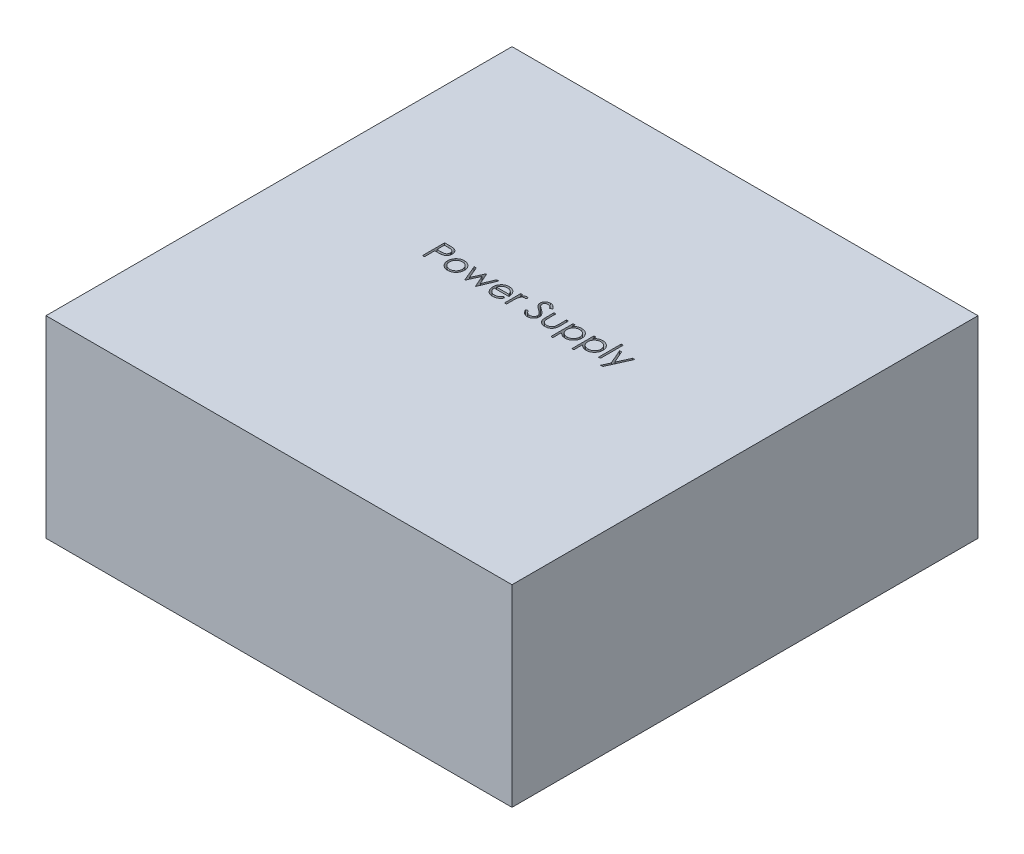
from build123d import *

# Parameters (mm, degrees)
SKETCH1_W           = 73.66
SKETCH1_H           = 73.66
BOSS_EXTRUDE1_DEPTH = 30.48
SKETCH2_W           = 0.314102564
SKETCH2_H           = 3.58974359
CUT_EXTRUDE1_DEPTH  = 3


with BuildPart() as part:
    # Sketch1 → Boss-Extrude1 (new body)
    with BuildSketch(Plane(origin=(0, 0, 0), x_dir=(1, 0, 0), z_dir=(0, 1, 0))):
        with Locations((-36.83, 36.83)):
            Rectangle(SKETCH1_W, SKETCH1_H)
    extrude(amount=BOSS_EXTRUDE1_DEPTH)

    # Sketch2 → Cut-Extrude1 (cut)
    # profile 1 of 11: a face of its own
    with BuildSketch(Plane(origin=(0, 30.48, 0), x_dir=(1, 0, 0), z_dir=(0, 1, 0))):
        with BuildLine():
            Line((-52.131282051, 41.489150847), (-51.444883814, 41.489150847))
            add(Edge.make_bspline(
                [(-51.444883814, 41.489150847), (-51.397672908, 41.489098951), (-51.307214715, 41.488999515), (-51.177499659, 41.485984769), (-51.059689928, 41.481958077), (-50.954039547, 41.476376184), (-50.860223449, 41.469779594), (-50.778666149, 41.460527555), (-50.708726593, 41.450867259), (-50.666820143, 41.441045852), (-50.647708333, 41.436566712)],
                knots=[0, 0, 0, 0, 1.415646017, 2.712440637, 3.8905458, 4.950247383, 5.884950622, 6.709939814, 7.411656543, 8, 8, 8, 8], degree=3))
            add(Edge.make_bspline(
                [(-50.647708333, 41.436566712), (-50.6235148, 41.429944763), (-50.575697822, 41.416856901), (-50.506796779, 41.390643177), (-50.441242934, 41.359561012), (-50.378811375, 41.324137072), (-50.320269292, 41.282851508), (-50.264743251, 41.23737789), (-50.212723271, 41.186666322), (-50.164501879, 41.131285582), (-50.120217082, 41.072165372), (-50.082087399, 41.008423142), (-50.050160172, 40.941131839), (-50.0227769, 40.870338268), (-50.003068446, 40.795447944), (-49.988221546, 40.716981232), (-49.978797918, 40.634946542), (-49.977895357, 40.578886674), (-49.977435897, 40.550348764)],
                knots=[0, 0, 0, 0, 0.999701418, 1.975846123, 2.934577507, 3.890451536, 4.834027766, 5.787354733, 6.749476667, 7.726910423, 8.712836071, 9.690891519, 10.682875813, 11.679750201, 12.712814741, 13.765529915, 14.8625177, 16, 16, 16, 16], degree=3))
            add(Edge.make_bspline(
                [(-49.977435897, 40.550348764), (-49.977857322, 40.521570987), (-49.978681868, 40.465265323), (-49.988578153, 40.382892535), (-50.001908345, 40.304174145), (-50.022405397, 40.229284694), (-50.04925107, 40.158668924), (-50.080743123, 40.091247692), (-50.118726654, 40.02816802), (-50.162371483, 39.969200902), (-50.210923078, 39.91429099), (-50.264176016, 39.863836195), (-50.321915308, 39.818131857), (-50.383957457, 39.777075513), (-50.450907305, 39.741619234), (-50.521749459, 39.709861929), (-50.597099675, 39.683190868), (-50.649242189, 39.669160807), (-50.675753205, 39.66202745)],
                knots=[0, 0, 0, 0, 1.121902311, 2.195077645, 3.232258892, 4.234102512, 5.217864754, 6.176164875, 7.132989551, 8.084763148, 9.034132444, 9.988522005, 10.94243251, 11.903244335, 12.886203696, 13.894208494, 14.929344452, 16, 16, 16, 16], degree=3))
            add(Edge.make_bspline(
                [(-50.675753205, 39.66202745), (-50.697680539, 39.657364469), (-50.745735566, 39.647145274), (-50.824878289, 39.635736818), (-50.917023675, 39.625999217), (-51.022045955, 39.618698079), (-51.139850859, 39.612447711), (-51.270502117, 39.607479617), (-51.414256194, 39.604749763), (-51.514527438, 39.60460897), (-51.566879006, 39.604535462)],
                knots=[0, 0, 0, 0, 0.601384939, 1.31797006, 2.144135048, 3.087295005, 4.142315834, 5.309527816, 6.595305764, 8, 8, 8, 8], degree=3))
            Line((-51.566879006, 39.604535462), (-51.817179487, 39.604535462))
            Line((-51.817179487, 39.604535462), (-51.817179487, 37.989150847))
            Line((-51.817179487, 37.989150847), (-52.131282051, 37.989150847))
            Line((-52.131282051, 37.989150847), (-52.131282051, 41.489150847))
        make_face()
        with BuildLine():
            Line((-51.817179487, 41.130176488), (-51.817179487, 39.963509821))
            Line((-51.817179487, 39.963509821), (-51.204399038, 39.955797482))
            add(Edge.make_bspline(
                [(-51.204399038, 39.955797482), (-51.174479113, 39.955782018), (-51.116719313, 39.955752166), (-51.033283089, 39.959737389), (-50.955873802, 39.964337922), (-50.884729227, 39.971073846), (-50.819817292, 39.980595103), (-50.761029763, 39.990206841), (-50.708822481, 40.004112204), (-50.647723279, 40.022835273), (-50.579639931, 40.054767888), (-50.505572383, 40.101117778), (-50.442801796, 40.160198487), (-50.3884835, 40.226626318), (-50.345377622, 40.300525447), (-50.313821629, 40.379594384), (-50.295280472, 40.463022234), (-50.292794278, 40.520110372), (-50.291538462, 40.54894652)],
                knots=[0, 0, 0, 0, 1.160613943, 2.240541288, 3.23993089, 4.169200891, 5.011653406, 5.7853311, 6.478053781, 7.106038997, 8.262395093, 9.384106736, 10.481365981, 11.59014053, 12.70357646, 13.786202915, 14.881775077, 16, 16, 16, 16], degree=3))
            add(Edge.make_bspline(
                [(-50.291538462, 40.54894652), (-50.292801108, 40.577085034), (-50.295311093, 40.633020916), (-50.313966956, 40.714999676), (-50.34531627, 40.793235381), (-50.388772865, 40.866208466), (-50.441513994, 40.93239727), (-50.502813338, 40.989894397), (-50.572526599, 41.0361161), (-50.63737483, 41.065949381), (-50.694976016, 41.084164657), (-50.745007976, 41.096909497), (-50.80149865, 41.107085104), (-50.86446643, 41.115324606), (-50.933423264, 41.122378068), (-51.008961579, 41.127164045), (-51.090795222, 41.129965501), (-51.147605793, 41.130104456), (-51.177055288, 41.130176488)],
                knots=[0, 0, 0, 0, 1.120700087, 2.227813068, 3.331159281, 4.466773991, 5.599788987, 6.693661531, 7.80175334, 8.91857717, 9.525282508, 10.207424825, 10.974604443, 11.810962634, 12.737642355, 13.736264703, 14.826523623, 16, 16, 16, 16], degree=3))
            Line((-51.177055288, 41.130176488), (-51.817179487, 41.130176488))
        make_face(mode=Mode.SUBTRACT)
    # profile 2 of 11: a face of its own
    with BuildSketch(Plane(origin=(0, 30.48, 0), x_dir=(1, 0, 0), z_dir=(0, 1, 0))):
        with BuildLine():
            add(Edge.make_bspline(
                [(-48.113854167, 40.59171495), (-48.065862894, 40.590693058), (-47.971763736, 40.58868938), (-47.83395585, 40.567274414), (-47.702410714, 40.53452705), (-47.576624522, 40.489255488), (-47.458208227, 40.428573537), (-47.345436983, 40.356164246), (-47.238619974, 40.270381652), (-47.174596945, 40.204023584), (-47.142099359, 40.170340751)],
                knots=[0, 0, 0, 0, 1.054011418, 2.066658804, 3.057071809, 4.030435133, 4.997543892, 5.974964718, 6.972108034, 8, 8, 8, 8], degree=3))
            add(Edge.make_bspline(
                [(-47.142099359, 40.170340751), (-47.114117405, 40.138126765), (-47.058695025, 40.074322223), (-46.987629306, 39.97086661), (-46.926407746, 39.863726509), (-46.877344785, 39.751479183), (-46.838659761, 39.635104511), (-46.811194065, 39.5142025), (-46.79485713, 39.389040153), (-46.792654163, 39.304036315), (-46.791538462, 39.260985783)],
                knots=[0, 0, 0, 0, 1.025258237, 2.030674902, 3.01204498, 3.988269485, 4.97094183, 5.956517959, 6.965070386, 8, 8, 8, 8], degree=3))
            add(Edge.make_bspline(
                [(-46.791538462, 39.260985783), (-46.792519799, 39.217685725), (-46.794458967, 39.132122792), (-46.812802584, 39.006103426), (-46.841333669, 38.883908603), (-46.882165508, 38.76604991), (-46.934523617, 38.652167082), (-46.998414304, 38.542757533), (-47.074285922, 38.4376054), (-47.160289918, 38.337603561), (-47.255341794, 38.245437347), (-47.358457943, 38.165109077), (-47.467611977, 38.096287553), (-47.58425533, 38.040851137), (-47.707322817, 37.997141437), (-47.837079885, 37.96644142), (-47.973324955, 37.947879737), (-48.066352176, 37.945496163), (-48.113854167, 37.944279052)],
                knots=[0, 0, 0, 0, 0.998656419, 1.973391657, 2.932242238, 3.890759089, 4.846373663, 5.82037756, 6.809684879, 7.83454468, 8.860553229, 9.859544525, 10.845671541, 11.83227036, 12.833544569, 13.85385346, 14.904124723, 16, 16, 16, 16], degree=3))
            add(Edge.make_bspline(
                [(-48.113854167, 37.944279052), (-48.161588886, 37.945500248), (-48.255079746, 37.947892023), (-48.391805728, 37.966369306), (-48.521795347, 37.997127288), (-48.645023945, 38.040994781), (-48.762168792, 38.096289325), (-48.871955289, 38.164901014), (-48.975155205, 38.245461169), (-49.070227189, 38.337597107), (-49.156225794, 38.437607063), (-49.232098803, 38.542757101), (-49.295989129, 38.652167195), (-49.348347333, 38.76604988), (-49.389179146, 38.883908611), (-49.417710238, 39.006103424), (-49.436053853, 39.132122792), (-49.437993022, 39.217685725), (-49.438974359, 39.260985783)],
                knots=[0, 0, 0, 0, 1.099876186, 2.154163076, 3.173186993, 4.173200201, 5.163417411, 6.152872554, 7.150605724, 8.17532212, 9.198891216, 10.186952605, 11.159729845, 12.11414092, 13.071450619, 14.029093627, 15.002601286, 16, 16, 16, 16], degree=3))
            add(Edge.make_bspline(
                [(-49.438974359, 39.260985783), (-49.437851049, 39.303802329), (-49.435627087, 39.388571731), (-49.419306578, 39.513498792), (-49.391948022, 39.634196181), (-49.353216625, 39.750121657), (-49.303701434, 39.861877093), (-49.243340146, 39.969281924), (-49.171549514, 40.072269724), (-49.116347562, 40.135991804), (-49.088413462, 40.168237385)],
                knots=[0, 0, 0, 0, 1.031353054, 2.041901799, 3.029428768, 4.008703097, 4.981709435, 5.96992636, 6.972712378, 8, 8, 8, 8], degree=3))
            add(Edge.make_bspline(
                [(-49.088413462, 40.168237385), (-49.055964871, 40.202212325), (-48.992149007, 40.269030021), (-48.884800279, 40.354562545), (-48.772306458, 40.428478619), (-48.652581532, 40.487954834), (-48.526898674, 40.534793352), (-48.394679431, 40.567358867), (-48.256403916, 40.588612222), (-48.161844295, 40.5906704), (-48.113854167, 40.59171495)],
                knots=[0, 0, 0, 0, 1.027980169, 2.021703884, 2.998553061, 3.971491411, 4.943284454, 5.930300938, 6.949603206, 8, 8, 8, 8], degree=3))
        make_face()
        with BuildLine():
            add(Edge.make_bspline(
                [(-48.11525641, 40.277612385), (-48.149194022, 40.276647794), (-48.21619315, 40.274743511), (-48.314812735, 40.260259607), (-48.409752889, 40.237312102), (-48.501193733, 40.204708046), (-48.588826905, 40.162609147), (-48.672736308, 40.110900787), (-48.753168748, 40.050267831), (-48.828550811, 39.980805159), (-48.897733123, 39.904926164), (-48.9582111, 39.824077806), (-49.009636206, 39.739571459), (-49.052476365, 39.651319248), (-49.084383553, 39.558426834), (-49.107556576, 39.461946203), (-49.122026816, 39.361680787), (-49.123913195, 39.293519768), (-49.124871795, 39.258882418)],
                knots=[0, 0, 0, 0, 1.021534396, 2.016698045, 2.994645724, 3.958388632, 4.93408049, 5.916473867, 6.921342795, 7.962252576, 8.998418191, 10.008913653, 10.997312074, 11.973003931, 12.956656626, 13.948281152, 14.957379055, 16, 16, 16, 16], degree=3))
            add(Edge.make_bspline(
                [(-49.124871795, 39.258882418), (-49.123264971, 39.21413039), (-49.120075727, 39.125305985), (-49.09414049, 38.994494862), (-49.05075421, 38.86891301), (-48.992166931, 38.749296624), (-48.918760712, 38.638624346), (-48.832273645, 38.539952862), (-48.733633945, 38.45476705), (-48.624017445, 38.384086205), (-48.505663127, 38.327926449), (-48.380406806, 38.288127473), (-48.249766112, 38.262255781), (-48.160485381, 38.259684307), (-48.11525641, 38.258381616)],
                knots=[0, 0, 0, 0, 1.016792936, 2.018143844, 3.017858371, 4.030088057, 5.03801393, 6.028138512, 7.003788237, 7.991172063, 8.984598303, 9.972568034, 10.972917682, 12, 12, 12, 12], degree=3))
            add(Edge.make_bspline(
                [(-48.11525641, 38.258381616), (-48.070030041, 38.259691897), (-47.980754445, 38.262278353), (-47.850295269, 38.287997173), (-47.725381297, 38.328100834), (-47.607149909, 38.384023044), (-47.497583306, 38.455035458), (-47.398234184, 38.539471836), (-47.312485573, 38.638885687), (-47.239151968, 38.749443216), (-47.179605226, 38.868727568), (-47.136422024, 38.99451804), (-47.110424438, 39.125300082), (-47.107243609, 39.214128413), (-47.105641026, 39.258882418)],
                knots=[0, 0, 0, 0, 1.02726834, 2.027799167, 3.010890988, 4.004497153, 4.992059811, 5.971914811, 6.958719428, 7.966827853, 8.981595046, 9.981490638, 10.983022906, 12, 12, 12, 12], degree=3))
            add(Edge.make_bspline(
                [(-47.105641026, 39.258882418), (-47.106599296, 39.293519975), (-47.108485025, 39.361681401), (-47.122959989, 39.461943855), (-47.146115529, 39.558435451), (-47.178087146, 39.651287454), (-47.22074116, 39.739799959), (-47.273157953, 39.823829686), (-47.333388978, 39.905206232), (-47.403406099, 39.980559873), (-47.478709477, 40.050294909), (-47.559174515, 40.110924299), (-47.642959494, 40.162381894), (-47.730338077, 40.205068135), (-47.821790644, 40.237015475), (-47.916597773, 40.260392107), (-48.014796583, 40.274682303), (-48.081555627, 40.276629445), (-48.11525641, 40.277612385)],
                knots=[0, 0, 0, 0, 1.042956736, 2.052379634, 3.044323526, 4.02829302, 5.004299113, 5.996692471, 7.007513377, 8.048758398, 9.090003419, 10.095195979, 11.07790575, 12.047570684, 13.018257071, 13.989683339, 14.985167495, 16, 16, 16, 16], degree=3))
        make_face(mode=Mode.SUBTRACT)
    # profile 3 of 11: a face of its own
    with BuildSketch(Plane(origin=(0, 30.48, 0), x_dir=(1, 0, 0), z_dir=(0, 1, 0))):
        Polygon((-46.522307692, 40.546843155), (-46.185068109, 40.546843155), (-45.422948718, 38.707099565), (-44.58791266, 40.546843155), (-44.534627404, 40.546843155), (-43.717820513, 38.707099565), (-42.948689904, 40.546843155), (-42.618461538, 40.546843155), (-43.687672276, 37.989150847), (-43.752876603, 37.989150847), (-44.570384615, 39.828894437), (-45.404719551, 37.989150847), (-45.46291266, 37.989150847), align=None)
    # profile 4 of 11: a face of its own
    with BuildSketch(Plane(origin=(0, 30.48, 0), x_dir=(1, 0, 0), z_dir=(0, 1, 0))):
        with BuildLine():
            Line((-40.115456731, 38.796843155), (-39.836410256, 38.6503087))
            add(Edge.make_bspline(
                [(-39.836410256, 38.6503087), (-39.858646852, 38.610865368), (-39.90191046, 38.534124266), (-39.976311208, 38.428692405), (-40.054303281, 38.333844689), (-40.139407249, 38.252115035), (-40.229076928, 38.18086365), (-40.323809582, 38.118525825), (-40.4240984, 38.065407305), (-40.529948125, 38.020654777), (-40.642247676, 37.986245283), (-40.761269192, 37.961941062), (-40.887240688, 37.946917793), (-40.973586868, 37.945172653), (-41.017800481, 37.944279052)],
                knots=[0, 0, 0, 0, 1.120438281, 2.179929193, 3.190490725, 4.156257408, 5.095198341, 6.022838206, 6.959905092, 7.901321166, 8.864066838, 9.862729781, 10.905609505, 12, 12, 12, 12], degree=3))
            add(Edge.make_bspline(
                [(-41.017800481, 37.944279052), (-41.066942458, 37.945426227), (-41.16280422, 37.947664034), (-41.302343967, 37.966956499), (-41.433723385, 37.998428857), (-41.556935089, 38.042394399), (-41.671677341, 38.099821723), (-41.778178196, 38.169781205), (-41.876997722, 38.251913459), (-41.965021931, 38.346929903), (-42.044265814, 38.44861186), (-42.114191634, 38.554567745), (-42.172649065, 38.664530969), (-42.220201675, 38.777801493), (-42.25860654, 38.893665387), (-42.285373244, 39.013176854), (-42.300802992, 39.136012439), (-42.303167437, 39.219109774), (-42.304358974, 39.260985783)],
                knots=[0, 0, 0, 0, 1.145258523, 2.234067595, 3.276747158, 4.290159414, 5.277019952, 6.260822364, 7.254936242, 8.264827045, 9.274100331, 10.257902744, 11.220704747, 12.172965371, 13.118907548, 14.062713208, 15.023725156, 16, 16, 16, 16], degree=3))
            add(Edge.make_bspline(
                [(-42.304358974, 39.260985783), (-42.303299833, 39.300280613), (-42.301200755, 39.378157778), (-42.287969967, 39.493423323), (-42.264521674, 39.605451775), (-42.23234535, 39.714336223), (-42.190794104, 39.819894357), (-42.139961885, 39.922190421), (-42.079769507, 40.021115561), (-42.033296833, 40.083518694), (-42.009887821, 40.114952129)],
                knots=[0, 0, 0, 0, 1.024358464, 2.0301432, 3.019427413, 4.004406732, 4.986367066, 5.972626655, 6.978780325, 8, 8, 8, 8], degree=3))
            add(Edge.make_bspline(
                [(-42.009887821, 40.114952129), (-41.978180138, 40.152820999), (-41.915769191, 40.22735915), (-41.810212836, 40.325297475), (-41.695912639, 40.407341251), (-41.574301013, 40.475348387), (-41.443964539, 40.527022034), (-41.306655248, 40.565529616), (-41.160809662, 40.587107627), (-41.061104441, 40.590155461), (-41.010088141, 40.59171495)],
                knots=[0, 0, 0, 0, 1.030682036, 2.02871468, 2.997146059, 3.962720338, 4.930598197, 5.918074684, 6.934738563, 8, 8, 8, 8], degree=3))
            add(Edge.make_bspline(
                [(-41.010088141, 40.59171495), (-40.957640536, 40.590360901), (-40.85475029, 40.587704565), (-40.704718169, 40.563078232), (-40.562757452, 40.524025677), (-40.428924948, 40.468871887), (-40.303207087, 40.397712335), (-40.186421038, 40.309570494), (-40.076569525, 40.207152406), (-40.012660946, 40.128389197), (-39.980140224, 40.088309501)],
                knots=[0, 0, 0, 0, 1.056321875, 2.072262726, 3.055038591, 4.01806755, 4.982017516, 5.957941055, 6.960871419, 8, 8, 8, 8], degree=3))
            add(Edge.make_bspline(
                [(-39.980140224, 40.088309501), (-39.958013286, 40.058105919), (-39.913906693, 39.997899801), (-39.858659593, 39.899728644), (-39.810702198, 39.797018049), (-39.772369237, 39.688107752), (-39.741329736, 39.574288172), (-39.718872917, 39.454745627), (-39.705703298, 39.329515716), (-39.703114601, 39.244189161), (-39.701794872, 39.200689309)],
                knots=[0, 0, 0, 0, 0.94817472, 1.890038105, 2.849395472, 3.817997239, 4.812318967, 5.836947057, 6.897266129, 8, 8, 8, 8], degree=3))
            Line((-39.701794872, 39.200689309), (-41.99025641, 39.200689309))
            add(Edge.make_bspline(
                [(-41.99025641, 39.200689309), (-41.988716804, 39.166988844), (-41.98568923, 39.100718241), (-41.971574087, 39.003747457), (-41.949325313, 38.911374115), (-41.91805625, 38.824291073), (-41.880189405, 38.741360946), (-41.833803688, 38.663198909), (-41.778464134, 38.590160979), (-41.716738435, 38.521593841), (-41.64803134, 38.46053308), (-41.575748592, 38.405881304), (-41.498855027, 38.360075707), (-41.417956944, 38.322895817), (-41.333185159, 38.293789501), (-41.244512964, 38.273921681), (-41.152114847, 38.260614574), (-41.089129113, 38.259134909), (-41.057063301, 38.258381616)],
                knots=[0, 0, 0, 0, 1.094153842, 2.151609401, 3.174256925, 4.172055639, 5.149267565, 6.128595816, 7.11444997, 8.118368179, 9.117203808, 10.09244225, 11.054858984, 12.015122123, 12.976791628, 13.957293641, 14.960065497, 16, 16, 16, 16], degree=3))
            add(Edge.make_bspline(
                [(-41.057063301, 38.258381616), (-41.025712154, 38.258989673), (-40.963505463, 38.260196174), (-40.870864605, 38.271928085), (-40.779725078, 38.290898361), (-40.690464095, 38.316788351), (-40.604893249, 38.348365203), (-40.525647699, 38.38646806), (-40.452767483, 38.428617807), (-40.384650517, 38.476827482), (-40.318579523, 38.535835669), (-40.253037037, 38.60947139), (-40.182760383, 38.696558918), (-40.138770791, 38.762104584), (-40.115456731, 38.796843155)],
                knots=[0, 0, 0, 0, 0.99110716, 1.966546729, 2.947904876, 3.932708344, 4.903319531, 5.828989031, 6.710028674, 7.56322171, 8.463672341, 9.504779593, 10.677557249, 12, 12, 12, 12], degree=3))
        make_face()
        with BuildLine():
            add(Edge.make_bspline(
                [(-40.015897436, 39.514791873), (-40.02739406, 39.556454746), (-40.049521362, 39.636642367), (-40.095757726, 39.747683257), (-40.147829267, 39.846371158), (-40.209450998, 39.931950791), (-40.279269724, 40.007954304), (-40.359914907, 40.07437289), (-40.4503508, 40.133790341), (-40.550109941, 40.18394284), (-40.655751726, 40.226632699), (-40.766357918, 40.255257815), (-40.879215706, 40.274867357), (-40.955549992, 40.276693465), (-40.99396234, 40.277612385)],
                knots=[0, 0, 0, 0, 1.154881502, 2.222775134, 3.210006277, 4.132804581, 5.035138423, 5.962687519, 6.919655026, 7.923214229, 8.944639381, 9.960483929, 10.97369054, 12, 12, 12, 12], degree=3))
            add(Edge.make_bspline(
                [(-40.99396234, 40.277612385), (-41.025311778, 40.277000714), (-41.087283027, 40.275791568), (-41.178584096, 40.264321439), (-41.266263794, 40.245361594), (-41.350969082, 40.219396637), (-41.43158995, 40.184788035), (-41.509784719, 40.144204808), (-41.583565115, 40.094663224), (-41.62970641, 40.056904369), (-41.653016827, 40.037828732)],
                knots=[0, 0, 0, 0, 1.04873581, 2.073130211, 3.073294108, 4.04793562, 5.032784715, 6.005352987, 6.992311501, 8, 8, 8, 8], degree=3))
            add(Edge.make_bspline(
                [(-41.653016827, 40.037828732), (-41.669710109, 40.022734416), (-41.703493243, 39.9921872), (-41.748633765, 39.939557993), (-41.791854237, 39.882806431), (-41.83118789, 39.819761307), (-41.867265477, 39.751140528), (-41.901025454, 39.677522892), (-41.931411866, 39.598349762), (-41.948507976, 39.543177323), (-41.957303686, 39.514791873)],
                knots=[0, 0, 0, 0, 0.879870761, 1.780643979, 2.707998968, 3.669668524, 4.684282772, 5.740141944, 6.837334558, 8, 8, 8, 8], degree=3))
            Line((-41.957303686, 39.514791873), (-40.015897436, 39.514791873))
        make_face(mode=Mode.SUBTRACT)
    # profile 5 of 11: a face of its own
    with BuildSketch(Plane(origin=(0, 30.48, 0), x_dir=(1, 0, 0), z_dir=(0, 1, 0))):
        with BuildLine():
            Line((-39.163333333, 40.546843155), (-38.849230769, 40.546843155))
            Line((-38.849230769, 40.546843155), (-38.849230769, 40.170340751))
            add(Edge.make_bspline(
                [(-38.849230769, 40.170340751), (-38.82604201, 40.205396579), (-38.78169369, 40.272440578), (-38.70798076, 40.361109879), (-38.632477429, 40.434524926), (-38.554822242, 40.493028445), (-38.474444142, 40.536841564), (-38.39310719, 40.568934599), (-38.30953172, 40.587911914), (-38.253369796, 40.590445573), (-38.225232372, 40.59171495)],
                knots=[0, 0, 0, 0, 1.2804753, 2.448899062, 3.506932113, 4.484331642, 5.4025378, 6.288909075, 7.142734305, 8, 8, 8, 8], degree=3))
            add(Edge.make_bspline(
                [(-38.225232372, 40.59171495), (-38.203406045, 40.590524423), (-38.15849696, 40.588074837), (-38.09051437, 40.570864013), (-38.020470918, 40.54338599), (-37.975328531, 40.517545767), (-37.951794872, 40.504074725)],
                knots=[0, 0, 0, 0, 0.901110191, 1.854092781, 2.881294221, 4, 4, 4, 4], degree=3))
            Line((-37.951794872, 40.504074725), (-38.124270833, 40.232039469))
            add(Edge.make_bspline(
                [(-38.124270833, 40.232039469), (-38.139379854, 40.238779735), (-38.168059669, 40.25157405), (-38.210014235, 40.26671606), (-38.248695572, 40.275631976), (-38.27333913, 40.276982694), (-38.284827724, 40.277612385)],
                knots=[0, 0, 0, 0, 1.180555205, 2.24091978, 3.179933427, 4, 4, 4, 4], degree=3))
            add(Edge.make_bspline(
                [(-38.284827724, 40.277612385), (-38.310033458, 40.275932348), (-38.361445848, 40.272505559), (-38.436930347, 40.245566751), (-38.510177553, 40.202041511), (-38.568349215, 40.153770399), (-38.613391468, 40.107222602), (-38.645531693, 40.066574199), (-38.67501444, 40.020995568), (-38.703184661, 39.971265884), (-38.728850955, 39.916536038), (-38.752805624, 39.857352824), (-38.774464487, 39.793647696), (-38.786814731, 39.749265175), (-38.793141026, 39.726530655)],
                knots=[0, 0, 0, 0, 1.125678352, 2.296057538, 3.5422874, 4.923748041, 5.663163013, 6.437101912, 7.23742474, 8.08941207, 8.991984279, 9.93940061, 10.944477711, 12, 12, 12, 12], degree=3))
            add(Edge.make_bspline(
                [(-38.793141026, 39.726530655), (-38.797873419, 39.706253481), (-38.808355311, 39.661341083), (-38.818546849, 39.585992558), (-38.828616367, 39.496968899), (-38.835712985, 39.394022306), (-38.842291027, 39.277409862), (-38.846001109, 39.146953917), (-38.84910425, 39.002520565), (-38.849187317, 38.901546212), (-38.849230769, 38.848726168)],
                knots=[0, 0, 0, 0, 0.566838948, 1.255505196, 2.06880316, 3.007127437, 4.065329342, 5.249902469, 6.561414163, 8, 8, 8, 8], degree=3))
            Line((-38.849230769, 38.848726168), (-38.849230769, 37.989150847))
            Line((-38.849230769, 37.989150847), (-39.163333333, 37.989150847))
            Line((-39.163333333, 37.989150847), (-39.163333333, 40.546843155))
        make_face()
    # profile 6 of 11: a face of its own
    with BuildSketch(Plane(origin=(0, 30.48, 0), x_dir=(1, 0, 0), z_dir=(0, 1, 0))):
        with BuildLine():
            Line((-36.560769231, 38.664331135), (-36.264895833, 38.84171495))
            add(Edge.make_bspline(
                [(-36.264895833, 38.84171495), (-36.237377596, 38.795650565), (-36.184653715, 38.707392981), (-36.096702356, 38.58813494), (-36.005569445, 38.486772784), (-35.910580112, 38.403896176), (-35.812314163, 38.338647289), (-35.71013011, 38.292445058), (-35.604372299, 38.263629082), (-35.532398478, 38.260128996), (-35.496466346, 38.258381616)],
                knots=[0, 0, 0, 0, 1.272034388, 2.437168799, 3.508375237, 4.49857839, 5.41946034, 6.295179144, 7.148887113, 8, 8, 8, 8], degree=3))
            add(Edge.make_bspline(
                [(-35.496466346, 38.258381616), (-35.465779486, 38.259236289), (-35.404942713, 38.260930679), (-35.31538047, 38.277211481), (-35.228398667, 38.30222361), (-35.14579003, 38.338044542), (-35.068694415, 38.381383027), (-35.00108772, 38.433729205), (-34.942641607, 38.49233541), (-34.894832492, 38.557718065), (-34.858152457, 38.628035214), (-34.829960388, 38.700211165), (-34.814315315, 38.775379733), (-34.811958561, 38.825990196), (-34.810769231, 38.851530655)],
                knots=[0, 0, 0, 0, 1.095163259, 2.171163733, 3.241058638, 4.321873601, 5.38011039, 6.391990106, 7.366004449, 8.327778327, 9.272591725, 10.192022065, 11.087607919, 12, 12, 12, 12], degree=3))
            add(Edge.make_bspline(
                [(-34.810769231, 38.851530655), (-34.812243541, 38.880671504), (-34.8152406, 38.939910594), (-34.84057208, 39.027310247), (-34.880421327, 39.113802817), (-34.91718397, 39.167304082), (-34.936270032, 39.195080334)],
                knots=[0, 0, 0, 0, 0.938893495, 1.908633276, 2.914225137, 4, 4, 4, 4], degree=3))
            add(Edge.make_bspline(
                [(-34.936270032, 39.195080334), (-34.951940646, 39.215127158), (-34.984839141, 39.257212956), (-35.041396653, 39.319858192), (-35.107762767, 39.384476611), (-35.181666322, 39.453535668), (-35.265799411, 39.523823464), (-35.357526926, 39.598691742), (-35.459190785, 39.675293319), (-35.530490281, 39.726665885), (-35.567279647, 39.753173283)],
                knots=[0, 0, 0, 0, 0.722233717, 1.516239348, 2.393582979, 3.351407094, 4.387010283, 5.505090956, 6.712668013, 8, 8, 8, 8], degree=3))
            add(Edge.make_bspline(
                [(-35.567279647, 39.753173283), (-35.604103644, 39.779401871), (-35.67450832, 39.829548933), (-35.772966903, 39.903973217), (-35.861011366, 39.972017086), (-35.938250382, 40.034321098), (-36.004649979, 40.090893703), (-36.06073339, 40.141191642), (-36.105071947, 40.186575203), (-36.129727528, 40.216016545), (-36.140797276, 40.229234982)],
                knots=[0, 0, 0, 0, 1.452282411, 2.77665338, 3.964542531, 5.026858415, 5.96415736, 6.766646006, 7.446254459, 8, 8, 8, 8], degree=3))
            add(Edge.make_bspline(
                [(-36.140797276, 40.229234982), (-36.156269821, 40.249836019), (-36.186698658, 40.290350722), (-36.226864663, 40.35367558), (-36.261003826, 40.418498845), (-36.287766158, 40.48499471), (-36.310302377, 40.552229639), (-36.325460308, 40.621080885), (-36.334951704, 40.691239503), (-36.335923691, 40.738453004), (-36.336410256, 40.762087546)],
                knots=[0, 0, 0, 0, 1.068054152, 2.10047183, 3.106115577, 4.101338837, 5.06977816, 6.043150881, 7.020423561, 8, 8, 8, 8], degree=3))
            add(Edge.make_bspline(
                [(-36.336410256, 40.762087546), (-36.335105047, 40.79911732), (-36.332522527, 40.872385384), (-36.31068201, 40.979416214), (-36.276209116, 41.081602632), (-36.227914229, 41.177932965), (-36.165656876, 41.265898946), (-36.093610901, 41.346512433), (-36.007799415, 41.414281016), (-35.913646792, 41.473493074), (-35.81059042, 41.519838999), (-35.702599516, 41.554799979), (-35.589502444, 41.574609237), (-35.51289931, 41.577452002), (-35.474030449, 41.578894437)],
                knots=[0, 0, 0, 0, 1.005424448, 1.989358655, 2.955360095, 3.929531133, 4.905563448, 5.876582895, 6.856512386, 7.866279853, 8.892233794, 9.918561126, 10.94386622, 12, 12, 12, 12], degree=3))
            add(Edge.make_bspline(
                [(-35.474030449, 41.578894437), (-35.432786348, 41.577471885), (-35.350764997, 41.574642884), (-35.230115781, 41.550045353), (-35.113955065, 41.509344681), (-35.0205118, 41.463156023), (-34.947379038, 41.417024607), (-34.891606306, 41.375004783), (-34.835088855, 41.326629674), (-34.7773708, 41.271770428), (-34.719430141, 41.209923677), (-34.660406688, 41.141512988), (-34.60016242, 41.066956432), (-34.561406559, 41.013731932), (-34.541538462, 40.98644652)],
                knots=[0, 0, 0, 0, 1.286793592, 2.559021753, 3.825965368, 5.121522368, 5.803751409, 6.523245864, 7.299691795, 8.125521123, 9.008227632, 9.944561021, 10.946284179, 12, 12, 12, 12], degree=3))
            Line((-34.541538462, 40.98644652), (-34.825492788, 40.771202129))
            add(Edge.make_bspline(
                [(-34.825492788, 40.771202129), (-34.842638721, 40.79329082), (-34.875657778, 40.835828473), (-34.925787265, 40.895399788), (-34.973035913, 40.949816268), (-35.019586313, 40.997081396), (-35.062979944, 41.039783529), (-35.105096986, 41.076343286), (-35.145331338, 41.107118881), (-35.196048248, 41.139962441), (-35.259765966, 41.172518945), (-35.339750503, 41.200068023), (-35.423336778, 41.216623085), (-35.480266409, 41.218811973), (-35.509086538, 41.219920078)],
                knots=[0, 0, 0, 0, 1.181633172, 2.275549214, 3.290209073, 4.226197932, 5.078386478, 5.862611352, 6.581680152, 7.217281963, 8.414376989, 9.595101626, 10.782541182, 12, 12, 12, 12], degree=3))
            add(Edge.make_bspline(
                [(-35.509086538, 41.219920078), (-35.545243061, 41.218708378), (-35.614967508, 41.216371729), (-35.713957744, 41.190851743), (-35.803051669, 41.150669883), (-35.879604235, 41.094354905), (-35.943341212, 41.027633912), (-35.98944667, 40.950855057), (-36.017196835, 40.866072655), (-36.020583115, 40.806930998), (-36.022307692, 40.776811103)],
                knots=[0, 0, 0, 0, 1.14458467, 2.207223713, 3.21896685, 4.227309161, 5.202851033, 6.127160689, 7.046193047, 8, 8, 8, 8], degree=3))
            add(Edge.make_bspline(
                [(-36.022307692, 40.776811103), (-36.021914566, 40.758059625), (-36.02112767, 40.720526005), (-36.010152872, 40.665074584), (-35.996053543, 40.609763244), (-35.973710911, 40.554840661), (-35.942865608, 40.499346302), (-35.902360432, 40.442324565), (-35.85134712, 40.383272856), (-35.812270107, 40.344865482), (-35.791638622, 40.324587546)],
                knots=[0, 0, 0, 0, 0.858281714, 1.717966888, 2.583508476, 3.4729293, 4.427298488, 5.488583878, 6.674047936, 8, 8, 8, 8], degree=3))
            add(Edge.make_bspline(
                [(-35.791638622, 40.324587546), (-35.783977249, 40.31775052), (-35.765775582, 40.301507312), (-35.732499657, 40.274915031), (-35.688556858, 40.242112259), (-35.635094657, 40.201524942), (-35.571127295, 40.15444348), (-35.496647739, 40.101469868), (-35.412486206, 40.040884409), (-35.35276429, 39.998526868), (-35.321185897, 39.976130014)],
                knots=[0, 0, 0, 0, 0.420754252, 0.999615792, 1.744751191, 2.668019286, 3.750313428, 4.999500688, 6.413464383, 8, 8, 8, 8], degree=3))
            add(Edge.make_bspline(
                [(-35.321185897, 39.976130014), (-35.283199984, 39.948488654), (-35.209645528, 39.894964992), (-35.104987948, 39.814549312), (-35.01009414, 39.735901544), (-34.924630936, 39.659523937), (-34.847754028, 39.585995844), (-34.780316307, 39.514432663), (-34.721630627, 39.445347091), (-34.658451408, 39.356774515), (-34.593893589, 39.247993431), (-34.538452081, 39.114715192), (-34.503493734, 38.980918872), (-34.498922218, 38.890992035), (-34.496666667, 38.846622802)],
                knots=[0, 0, 0, 0, 1.163667725, 2.253281268, 3.268753668, 4.215851969, 5.092017293, 5.902905408, 6.650798638, 7.335211899, 8.59617414, 9.77448103, 10.901945474, 12, 12, 12, 12], degree=3))
            add(Edge.make_bspline(
                [(-34.496666667, 38.846622802), (-34.497323805, 38.815244437), (-34.49862532, 38.753097054), (-34.513586234, 38.661841977), (-34.535505899, 38.573211107), (-34.568543133, 38.488299995), (-34.608866291, 38.405555232), (-34.660032539, 38.327147331), (-34.719340224, 38.251340933), (-34.787373989, 38.180157441), (-34.861819891, 38.114811245), (-34.940503585, 38.056682184), (-35.023553858, 38.008213861), (-35.110520175, 37.968663019), (-35.201422512, 37.937729501), (-35.296230296, 37.915316632), (-35.395099807, 37.901560921), (-35.462300288, 37.90013316), (-35.496466346, 37.899407257)],
                knots=[0, 0, 0, 0, 0.983748083, 1.948392443, 2.894712957, 3.844097841, 4.80183111, 5.778335162, 6.776009319, 7.81870978, 8.863265674, 9.881300176, 10.883814829, 11.87499822, 12.874611388, 13.892143829, 14.928324115, 16, 16, 16, 16], degree=3))
            add(Edge.make_bspline(
                [(-35.496466346, 37.899407257), (-35.522901689, 37.899918439), (-35.575439449, 37.900934364), (-35.653148931, 37.909915645), (-35.72928852, 37.922622748), (-35.802902802, 37.942796818), (-35.874940214, 37.967273795), (-35.945087448, 37.997412128), (-36.013378502, 38.033529329), (-36.080196085, 38.074824354), (-36.14537026, 38.122882099), (-36.208289728, 38.178855595), (-36.271018913, 38.2412011), (-36.33170631, 38.311611663), (-36.391579454, 38.388949746), (-36.449457863, 38.47393893), (-36.506539581, 38.566116283), (-36.542355049, 38.630981369), (-36.560769231, 38.664331135)],
                knots=[0, 0, 0, 0, 0.915332311, 1.819136955, 2.706846663, 3.586547465, 4.459518054, 5.340707479, 6.227863349, 7.133153174, 8.059268498, 9.028702269, 10.047606654, 11.120612155, 12.245963614, 13.433783089, 14.680604001, 16, 16, 16, 16], degree=3))
        make_face()
    # profile 7 of 11: a face of its own
    with BuildSketch(Plane(origin=(0, 30.48, 0), x_dir=(1, 0, 0), z_dir=(0, 1, 0))):
        with BuildLine():
            Line((-33.913333333, 40.546843155), (-33.599230769, 40.546843155))
            Line((-33.599230769, 40.546843155), (-33.599230769, 39.360545078))
            add(Edge.make_bspline(
                [(-33.599230769, 39.360545078), (-33.599088864, 39.325722329), (-33.598817407, 39.259108041), (-33.596976466, 39.163252854), (-33.592646372, 39.075836141), (-33.587232548, 38.996807404), (-33.580270412, 38.926180013), (-33.571987051, 38.864200656), (-33.56272863, 38.810166472), (-33.553665916, 38.777623116), (-33.549451122, 38.762488187)],
                knots=[0, 0, 0, 0, 1.388932606, 2.656963016, 3.823490214, 4.879454478, 5.816252168, 6.653371382, 7.373723809, 8, 8, 8, 8], degree=3))
            add(Edge.make_bspline(
                [(-33.549451122, 38.762488187), (-33.542689667, 38.743465316), (-33.529307326, 38.705815055), (-33.505033842, 38.65142605), (-33.475005505, 38.601050767), (-33.442145678, 38.552746694), (-33.40424627, 38.507944707), (-33.361786799, 38.466720464), (-33.316188562, 38.427516373), (-33.248433538, 38.381131581), (-33.155774272, 38.33141625), (-33.034121517, 38.288520432), (-32.902217291, 38.262884612), (-32.811052572, 38.259910357), (-32.764194712, 38.258381616)],
                knots=[0, 0, 0, 0, 0.725840625, 1.436591201, 2.137033971, 2.831655856, 3.53531722, 4.242432219, 4.957935707, 5.694543706, 7.190802206, 8.724350549, 10.316345118, 12, 12, 12, 12], degree=3))
            add(Edge.make_bspline(
                [(-32.764194712, 38.258381616), (-32.717341204, 38.259942865), (-32.626688336, 38.262963592), (-32.496233366, 38.287747131), (-32.376981952, 38.32915282), (-32.270131001, 38.386960231), (-32.17616516, 38.457702294), (-32.097860742, 38.540711103), (-32.033253487, 38.63336049), (-32.005044066, 38.702484769), (-31.990857372, 38.737247802)],
                knots=[0, 0, 0, 0, 1.157059328, 2.238695713, 3.266970494, 4.264342957, 5.228770407, 6.160125903, 7.074715775, 8, 8, 8, 8], degree=3))
            add(Edge.make_bspline(
                [(-31.990857372, 38.737247802), (-31.986663142, 38.751214101), (-31.977390723, 38.782090176), (-31.967428372, 38.834469925), (-31.95845391, 38.896934529), (-31.950790734, 38.969892738), (-31.945325572, 39.05315389), (-31.942379545, 39.146691966), (-31.93905127, 39.250213327), (-31.939000753, 39.322681086), (-31.938974359, 39.360545078)],
                knots=[0, 0, 0, 0, 0.557542046, 1.232589297, 2.036731608, 2.971723315, 4.038036528, 5.22795436, 6.551621927, 8, 8, 8, 8], degree=3))
            Line((-31.938974359, 39.360545078), (-31.938974359, 40.546843155))
            Line((-31.938974359, 40.546843155), (-31.624871795, 40.546843155))
            Line((-31.624871795, 40.546843155), (-31.624871795, 39.301650847))
            add(Edge.make_bspline(
                [(-31.624871795, 39.301650847), (-31.62531349, 39.259343676), (-31.626170438, 39.177261976), (-31.631677782, 39.057977864), (-31.641127394, 38.946815619), (-31.655470079, 38.843716399), (-31.672335754, 38.748758918), (-31.694092027, 38.661821472), (-31.720070264, 38.583171918), (-31.749375779, 38.511430141), (-31.783997647, 38.446383247), (-31.820824668, 38.38464743), (-31.863349439, 38.327754495), (-31.908119674, 38.272872358), (-31.957921329, 38.22273083), (-32.011821188, 38.176179354), (-32.069060608, 38.132506323), (-32.130909806, 38.093415043), (-32.196465869, 38.058198398), (-32.265809726, 38.02698232), (-32.339790724, 38.002279743), (-32.417454361, 37.980969077), (-32.499181141, 37.964254608), (-32.584892274, 37.952468041), (-32.67455889, 37.94524271), (-32.73566835, 37.944605665), (-32.766999199, 37.944279052)],
                knots=[0, 0, 0, 0, 1.493040784, 2.896703357, 4.213163133, 5.428574705, 6.569057535, 7.615249723, 8.588095153, 9.490268104, 10.346124644, 11.18633936, 12.024365274, 12.850166724, 13.684164916, 14.514361689, 15.362232829, 16.222528818, 17.093394965, 17.986930858, 18.902426812, 19.842810585, 20.827885679, 21.843828298, 22.894529745, 24, 24, 24, 24], degree=3))
            add(Edge.make_bspline(
                [(-32.766999199, 37.944279052), (-32.798095713, 37.944618759), (-32.859203258, 37.945286315), (-32.948874502, 37.952428123), (-33.034823108, 37.964236294), (-33.116743507, 37.981091511), (-33.194717904, 38.002130581), (-33.269062144, 38.027134117), (-33.338905707, 38.058214598), (-33.405087711, 38.093192156), (-33.467090099, 38.132757431), (-33.525198677, 38.176125471), (-33.57933553, 38.223231534), (-33.629512598, 38.273878891), (-33.675025575, 38.328695827), (-33.716441616, 38.387241388), (-33.754398321, 38.448935476), (-33.788751112, 38.514998639), (-33.818262867, 38.587570649), (-33.844318113, 38.667867746), (-33.865628752, 38.756770262), (-33.88297122, 38.854202191), (-33.896922661, 38.959697233), (-33.906608803, 39.073865648), (-33.912024634, 39.19642934), (-33.912887695, 39.28107923), (-33.913333333, 39.324787866)],
                knots=[0, 0, 0, 0, 1.083640291, 2.129454052, 3.13281866, 4.105697902, 5.042300162, 5.946461698, 6.836384745, 7.703652036, 8.553297018, 9.397182691, 10.228592656, 11.052265423, 11.879314572, 12.708807002, 13.549817954, 14.402308542, 15.300838682, 16.27712199, 17.341985831, 18.484375296, 19.725102775, 21.0496083, 22.476576903, 24, 24, 24, 24], degree=3))
            Line((-33.913333333, 39.324787866), (-33.913333333, 40.546843155))
        make_face()
    # profile 8 of 11: a face of its own
    with BuildSketch(Plane(origin=(0, 30.48, 0), x_dir=(1, 0, 0), z_dir=(0, 1, 0))):
        with BuildLine():
            Line((-30.906923077, 40.546843155), (-30.592820513, 40.546843155))
            Line((-30.592820513, 40.546843155), (-30.592820513, 40.073585943))
            add(Edge.make_bspline(
                [(-30.592820513, 40.073585943), (-30.559463029, 40.116523677), (-30.494639434, 40.19996457), (-30.382914529, 40.307954698), (-30.26498772, 40.399030002), (-30.137824308, 40.470412535), (-30.003400618, 40.524233347), (-29.8622683, 40.564012797), (-29.713229535, 40.587454272), (-29.611333083, 40.590275933), (-29.559366987, 40.59171495)],
                knots=[0, 0, 0, 0, 1.0828784, 2.104357462, 3.088488658, 4.04616522, 5.001424249, 5.969181776, 6.964304535, 8, 8, 8, 8], degree=3))
            add(Edge.make_bspline(
                [(-29.559366987, 40.59171495), (-29.513975384, 40.590401771), (-29.424256496, 40.587806204), (-29.292193267, 40.570233149), (-29.165017883, 40.540115457), (-29.043449829, 40.496714541), (-28.926186764, 40.443059071), (-28.814964664, 40.375342036), (-28.708051109, 40.296935845), (-28.60813492, 40.206703694), (-28.515813552, 40.109075428), (-28.435967371, 40.004053124), (-28.367095467, 39.895090537), (-28.31142517, 39.780498445), (-28.267816823, 39.661179215), (-28.236802145, 39.536650774), (-28.218344502, 39.407374834), (-28.21586805, 39.319472113), (-28.214615385, 39.275008219)],
                knots=[0, 0, 0, 0, 1.041296284, 2.058176809, 3.050446431, 4.034000596, 5.01514041, 6.003636468, 7.015969324, 8.052561599, 9.08815499, 10.094063707, 11.074456064, 12.040834395, 13.011057502, 13.983766392, 14.980127149, 16, 16, 16, 16], degree=3))
            add(Edge.make_bspline(
                [(-28.214615385, 39.275008219), (-28.21584087, 39.22960591), (-28.218257705, 39.140066006), (-28.23700271, 39.008578909), (-28.266959585, 38.882091535), (-28.310017768, 38.760814271), (-28.365659256, 38.64483062), (-28.433363816, 38.534224224), (-28.513250284, 38.429030521), (-28.604551411, 38.330677621), (-28.703604347, 38.240078308), (-28.809481837, 38.160840238), (-28.920540762, 38.094298863), (-29.03621293, 38.038715903), (-29.157488568, 37.996823719), (-29.283801846, 37.966605918), (-29.415083992, 37.947971423), (-29.504385144, 37.94551928), (-29.549551282, 37.944279052)],
                knots=[0, 0, 0, 0, 1.038740735, 2.04854663, 3.033179607, 4.009277356, 4.987731542, 5.972001279, 6.972200261, 8.005528982, 9.039189865, 10.040446548, 11.026516639, 11.997840187, 12.972163198, 13.956796175, 14.96660207, 16, 16, 16, 16], degree=3))
            add(Edge.make_bspline(
                [(-29.549551282, 37.944279052), (-29.600378854, 37.94557386), (-29.70077821, 37.948131485), (-29.84757588, 37.974050895), (-29.988852732, 38.01278783), (-30.123043557, 38.069486824), (-30.25121137, 38.14174234), (-30.372631175, 38.229852546), (-30.487947928, 38.333633171), (-30.557356686, 38.412364987), (-30.592820513, 38.452592353)],
                knots=[0, 0, 0, 0, 1.014726462, 2.004382257, 2.969841629, 3.936926163, 4.907207904, 5.903978561, 6.929055279, 8, 8, 8, 8], degree=3))
            Line((-30.592820513, 38.452592353), (-30.592820513, 37.046843155))
            Line((-30.592820513, 37.046843155), (-30.906923077, 37.046843155))
            Line((-30.906923077, 37.046843155), (-30.906923077, 40.546843155))
        make_face()
        with BuildLine():
            add(Edge.make_bspline(
                [(-29.562171474, 40.277612385), (-29.597751037, 40.276972127), (-29.667798025, 40.275711624), (-29.770470244, 40.260737675), (-29.869365671, 40.238999934), (-29.963487623, 40.206088034), (-30.053738239, 40.16568922), (-30.139422404, 40.115207209), (-30.220479972, 40.055555203), (-30.296707002, 39.98787586), (-30.365570295, 39.913301171), (-30.426533223, 39.833713362), (-30.477740528, 39.749213223), (-30.520242549, 39.66058786), (-30.552585831, 39.567142575), (-30.575541551, 39.469409562), (-30.589971904, 39.36728185), (-30.591860841, 39.297725843), (-30.592820513, 39.262388027)],
                knots=[0, 0, 0, 0, 1.05670511, 2.080379991, 3.077984906, 4.06214886, 5.038337365, 6.01289324, 7.01187578, 8.025460281, 9.038092164, 10.024533457, 11.000252242, 11.969694649, 12.940728589, 13.933144304, 14.949937299, 16, 16, 16, 16], degree=3))
            add(Edge.make_bspline(
                [(-30.592820513, 39.262388027), (-30.591229657, 39.215999914), (-30.588113035, 39.125121673), (-30.562775667, 38.992337551), (-30.521540403, 38.866685895), (-30.463011689, 38.749224858), (-30.389064115, 38.641242023), (-30.299965959, 38.544551417), (-30.196523407, 38.459760826), (-30.080456216, 38.388339572), (-29.956034085, 38.330351506), (-29.826248173, 38.288837295), (-29.692883292, 38.263265067), (-29.602714972, 38.260018248), (-29.557263622, 38.258381616)],
                knots=[0, 0, 0, 0, 1.03728447, 2.032128127, 3.01272805, 3.987917167, 4.958271349, 5.931593992, 6.91984656, 7.941419022, 8.973179163, 9.983609215, 10.983593296, 12, 12, 12, 12], degree=3))
            add(Edge.make_bspline(
                [(-29.557263622, 38.258381616), (-29.512727854, 38.259937993), (-29.424332361, 38.263027121), (-29.294174239, 38.289765309), (-29.167683601, 38.330610334), (-29.047503429, 38.39016989), (-28.934679941, 38.463159948), (-28.832798387, 38.550719981), (-28.743791474, 38.652209924), (-28.667927119, 38.765218427), (-28.606795633, 38.886393811), (-28.560865393, 39.0117752), (-28.53435682, 39.140920623), (-28.530600032, 39.227918336), (-28.528717949, 39.27150261)],
                knots=[0, 0, 0, 0, 1.00104056, 1.986885549, 2.97790532, 3.984399681, 4.995088187, 5.994304198, 6.996462723, 8.023150851, 9.048424203, 10.043036403, 11.019596776, 12, 12, 12, 12], degree=3))
            add(Edge.make_bspline(
                [(-28.528717949, 39.27150261), (-28.530172683, 39.315357599), (-28.533070816, 39.402725903), (-28.561617854, 39.531488806), (-28.604517832, 39.657376782), (-28.667076884, 39.776897331), (-28.741278153, 39.889671414), (-28.83102515, 39.989225293), (-28.931641347, 40.076395966), (-29.044330511, 40.148411376), (-29.165270936, 40.205696871), (-29.292585852, 40.24758051), (-29.425629454, 40.272754259), (-29.516257109, 40.275978765), (-29.562171474, 40.277612385)],
                knots=[0, 0, 0, 0, 0.983928682, 1.960191568, 2.949917689, 3.96440592, 4.982380491, 5.975291189, 6.965713506, 7.964880129, 8.970154049, 9.96478489, 10.968906225, 12, 12, 12, 12], degree=3))
        make_face(mode=Mode.SUBTRACT)
    # profile 9 of 11: a face of its own
    with BuildSketch(Plane(origin=(0, 30.48, 0), x_dir=(1, 0, 0), z_dir=(0, 1, 0))):
        with BuildLine():
            Line((-27.586410256, 40.546843155), (-27.272307692, 40.546843155))
            Line((-27.272307692, 40.546843155), (-27.272307692, 40.073585943))
            add(Edge.make_bspline(
                [(-27.272307692, 40.073585943), (-27.238950208, 40.116523677), (-27.174126614, 40.19996457), (-27.062401709, 40.307954698), (-26.9444749, 40.399030002), (-26.817311487, 40.470412535), (-26.682887797, 40.524233347), (-26.54175548, 40.564012797), (-26.392716715, 40.587454272), (-26.290820262, 40.590275933), (-26.238854167, 40.59171495)],
                knots=[0, 0, 0, 0, 1.0828784, 2.104357462, 3.088488658, 4.04616522, 5.001424249, 5.969181776, 6.964304535, 8, 8, 8, 8], degree=3))
            add(Edge.make_bspline(
                [(-26.238854167, 40.59171495), (-26.193462563, 40.590401771), (-26.103743675, 40.587806204), (-25.971680446, 40.570233149), (-25.844505063, 40.540115457), (-25.722937009, 40.496714541), (-25.605673944, 40.443059071), (-25.494451844, 40.375342036), (-25.387538288, 40.296935845), (-25.287622099, 40.206703694), (-25.195300731, 40.109075428), (-25.11545455, 40.004053124), (-25.046582646, 39.895090537), (-24.99091235, 39.780498445), (-24.947304002, 39.661179215), (-24.916289325, 39.536650774), (-24.897831681, 39.407374834), (-24.895355229, 39.319472113), (-24.894102564, 39.275008219)],
                knots=[0, 0, 0, 0, 1.041296284, 2.058176809, 3.050446431, 4.034000596, 5.01514041, 6.003636468, 7.015969324, 8.052561599, 9.08815499, 10.094063707, 11.074456064, 12.040834395, 13.011057502, 13.983766392, 14.980127149, 16, 16, 16, 16], degree=3))
            add(Edge.make_bspline(
                [(-24.894102564, 39.275008219), (-24.89532805, 39.22960591), (-24.897744884, 39.140066006), (-24.91648989, 39.008578909), (-24.946446764, 38.882091535), (-24.989504947, 38.760814271), (-25.045146436, 38.64483062), (-25.112850996, 38.534224224), (-25.192737463, 38.429030521), (-25.284038591, 38.330677621), (-25.383091527, 38.240078308), (-25.488969016, 38.160840238), (-25.600027942, 38.094298863), (-25.715700109, 38.038715903), (-25.836975748, 37.996823719), (-25.963289025, 37.966605918), (-26.094571172, 37.947971423), (-26.183872324, 37.94551928), (-26.229038462, 37.944279052)],
                knots=[0, 0, 0, 0, 1.038740735, 2.04854663, 3.033179607, 4.009277356, 4.987731542, 5.972001279, 6.972200261, 8.005528982, 9.039189865, 10.040446548, 11.026516639, 11.997840187, 12.972163198, 13.956796175, 14.96660207, 16, 16, 16, 16], degree=3))
            add(Edge.make_bspline(
                [(-26.229038462, 37.944279052), (-26.279866033, 37.94557386), (-26.38026539, 37.948131485), (-26.52706306, 37.974050895), (-26.668339912, 38.01278783), (-26.802530737, 38.069486824), (-26.930698549, 38.14174234), (-27.052118355, 38.229852546), (-27.167435108, 38.333633171), (-27.236843865, 38.412364987), (-27.272307692, 38.452592353)],
                knots=[0, 0, 0, 0, 1.014726462, 2.004382257, 2.969841629, 3.936926163, 4.907207904, 5.903978561, 6.929055279, 8, 8, 8, 8], degree=3))
            Line((-27.272307692, 38.452592353), (-27.272307692, 37.046843155))
            Line((-27.272307692, 37.046843155), (-27.586410256, 37.046843155))
            Line((-27.586410256, 37.046843155), (-27.586410256, 40.546843155))
        make_face()
        with BuildLine():
            add(Edge.make_bspline(
                [(-26.241658654, 40.277612385), (-26.277238216, 40.276972127), (-26.347285204, 40.275711624), (-26.449957423, 40.260737675), (-26.548852851, 40.238999934), (-26.642974802, 40.206088034), (-26.733225419, 40.16568922), (-26.818909583, 40.115207209), (-26.899967151, 40.055555203), (-26.976194181, 39.98787586), (-27.045057475, 39.913301171), (-27.106020403, 39.833713362), (-27.157227708, 39.749213223), (-27.199729728, 39.66058786), (-27.232073011, 39.567142575), (-27.255028731, 39.469409562), (-27.269459083, 39.36728185), (-27.271348021, 39.297725843), (-27.272307692, 39.262388027)],
                knots=[0, 0, 0, 0, 1.05670511, 2.080379991, 3.077984906, 4.06214886, 5.038337365, 6.01289324, 7.01187578, 8.025460281, 9.038092164, 10.024533457, 11.000252242, 11.969694649, 12.940728589, 13.933144304, 14.949937299, 16, 16, 16, 16], degree=3))
            add(Edge.make_bspline(
                [(-27.272307692, 39.262388027), (-27.270716836, 39.215999914), (-27.267600214, 39.125121673), (-27.242262846, 38.992337551), (-27.201027582, 38.866685895), (-27.142498869, 38.749224858), (-27.068551294, 38.641242023), (-26.979453138, 38.544551417), (-26.876010587, 38.459760826), (-26.759943395, 38.388339572), (-26.635521265, 38.330351506), (-26.505735353, 38.288837295), (-26.372370472, 38.263265067), (-26.282202152, 38.260018248), (-26.236750801, 38.258381616)],
                knots=[0, 0, 0, 0, 1.03728447, 2.032128127, 3.01272805, 3.987917167, 4.958271349, 5.931593992, 6.91984656, 7.941419022, 8.973179163, 9.983609215, 10.983593296, 12, 12, 12, 12], degree=3))
            add(Edge.make_bspline(
                [(-26.236750801, 38.258381616), (-26.192215033, 38.259937993), (-26.10381954, 38.263027121), (-25.973661419, 38.289765309), (-25.84717078, 38.330610334), (-25.726990608, 38.39016989), (-25.61416712, 38.463159948), (-25.512285567, 38.550719981), (-25.423278653, 38.652209924), (-25.347414298, 38.765218427), (-25.286282813, 38.886393811), (-25.240352573, 39.0117752), (-25.213844, 39.140920623), (-25.210087211, 39.227918336), (-25.208205128, 39.27150261)],
                knots=[0, 0, 0, 0, 1.00104056, 1.986885549, 2.97790532, 3.984399681, 4.995088187, 5.994304198, 6.996462723, 8.023150851, 9.048424203, 10.043036403, 11.019596776, 12, 12, 12, 12], degree=3))
            add(Edge.make_bspline(
                [(-25.208205128, 39.27150261), (-25.209659862, 39.315357599), (-25.212557996, 39.402725903), (-25.241105034, 39.531488806), (-25.284005011, 39.657376782), (-25.346564063, 39.776897331), (-25.420765333, 39.889671414), (-25.51051233, 39.989225293), (-25.611128526, 40.076395966), (-25.72381769, 40.148411376), (-25.844758116, 40.205696871), (-25.972073031, 40.24758051), (-26.105116634, 40.272754259), (-26.195744288, 40.275978765), (-26.241658654, 40.277612385)],
                knots=[0, 0, 0, 0, 0.983928682, 1.960191568, 2.949917689, 3.96440592, 4.982380491, 5.975291189, 6.965713506, 7.964880129, 8.970154049, 9.96478489, 10.968906225, 12, 12, 12, 12], degree=3))
        make_face(mode=Mode.SUBTRACT)
    # profile 10 of 11: a face of its own
    with BuildSketch(Plane(origin=(0, 30.48, 0), x_dir=(1, 0, 0), z_dir=(0, 1, 0))):
        with Locations((-24.153717949, 39.784022642)):
            Rectangle(SKETCH2_W, SKETCH2_H)
    # profile 11 of 11: a face of its own
    with BuildSketch(Plane(origin=(0, 30.48, 0), x_dir=(1, 0, 0), z_dir=(0, 1, 0))):
        Polygon((-23.547948718, 40.546843155), (-23.209306891, 40.546843155), (-22.343421474, 38.58790886), (-21.464214744, 40.546843155), (-21.124871795, 40.546843155), (-22.695384615, 37.046843155), (-23.034727564, 37.046843155), (-22.513794071, 38.207199725), align=None)
    extrude(amount=-CUT_EXTRUDE1_DEPTH, mode=Mode.SUBTRACT)


solid = part.part
